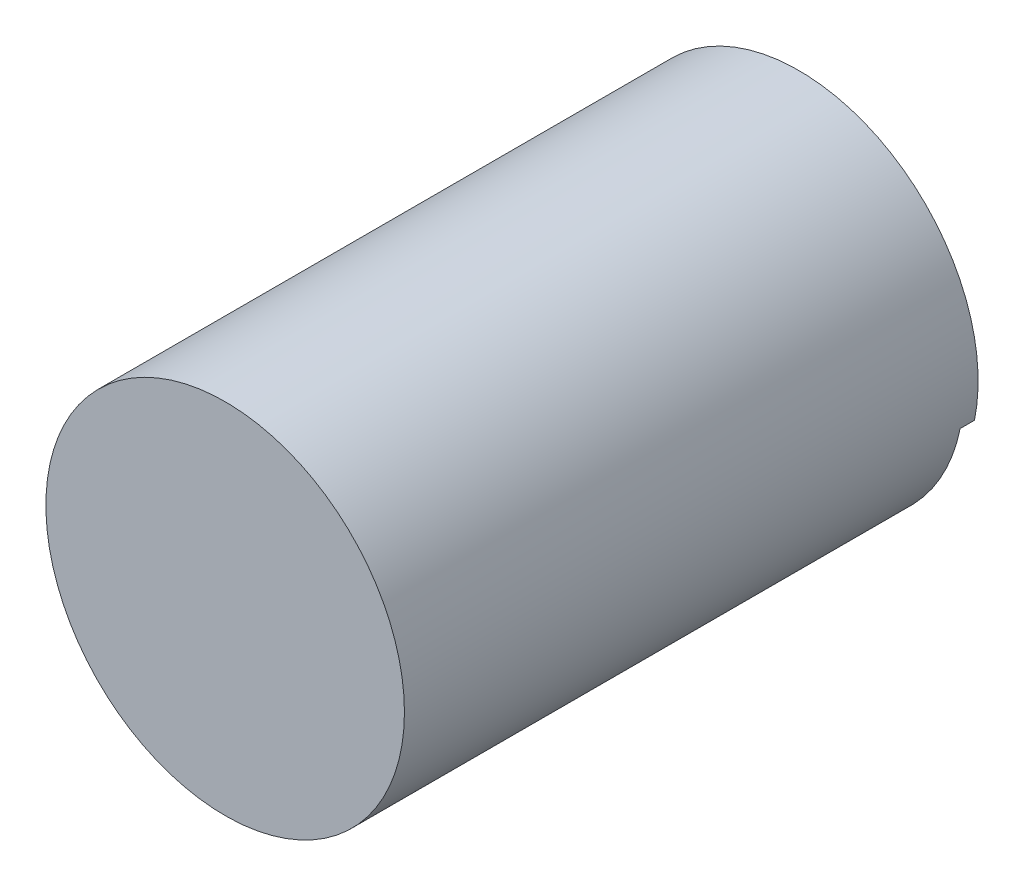
from build123d import *

# Parameters (mm, degrees)
SKETCH_1_R          = 25
EXTRUDE_1_DEPTH     = 80
CUT_EXTRUDE_1_DEPTH = 2


with BuildPart() as part:
    # 草图1 → 凸台-拉伸1 (new body)
    with BuildSketch(Plane.XY):
        Circle(SKETCH_1_R)
    extrude(amount=EXTRUDE_1_DEPTH)

    # 草图2 → 切除-拉伸1 (cut)
    with BuildSketch(Plane(origin=(0, 0, 0), x_dir=(-1, 0, 0), z_dir=(0, 0, -1))):
        with BuildLine():
            Line((19.074750083, -11.012812095), (21.650635095, -12.5))
            ThreePointArc((21.650635095, -12.5), (-4.010605572, -24.676203982), (-24.494897428, -5))
            ThreePointArc((-24.494897428, -5), (-15.811388301, 9.364916731), (0, 15))
            ThreePointArc((0, 15), (16.128487869, 6.826744229), (19.074750083, -11.012812095))
        make_face()
    extrude(amount=-CUT_EXTRUDE_1_DEPTH, mode=Mode.SUBTRACT)


solid = part.part
